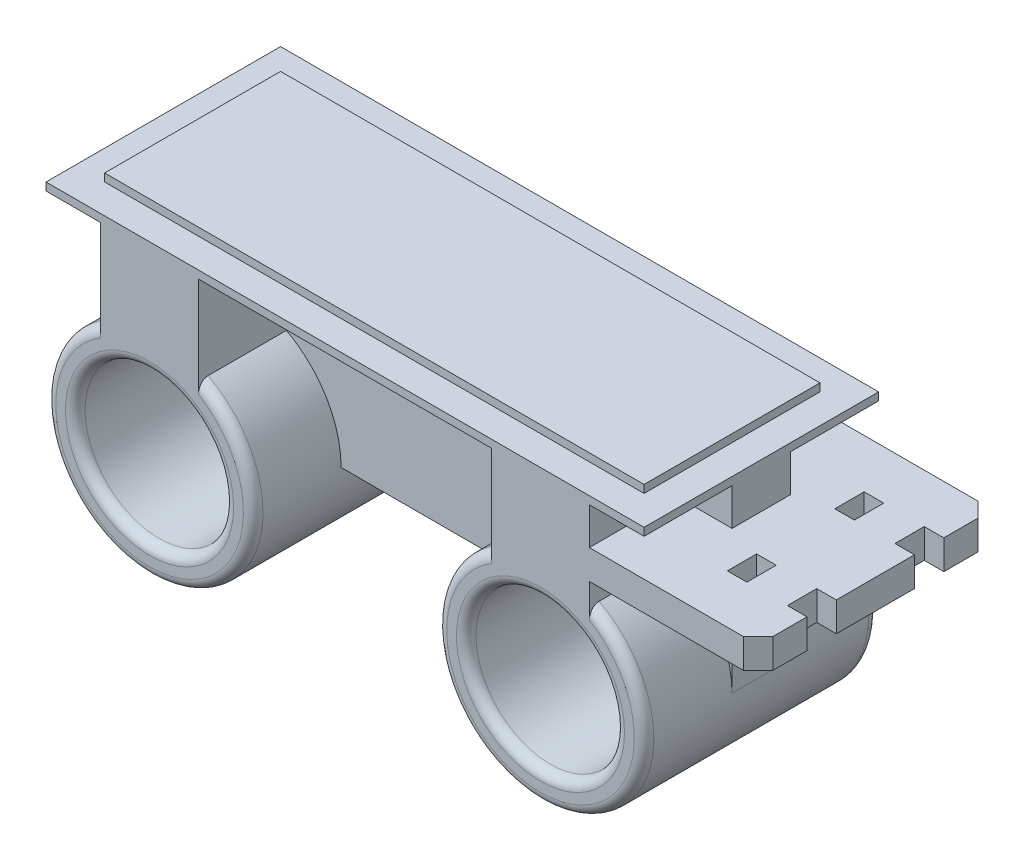
from build123d import *

# Parameters (mm, degrees)
ESBO_O1_R                  = 10.6
ESBO_O1_R_2                = 7.6
RESSALTO_EXTRUS_O1_DEPTH   = 12
RESSALTO_EXTRUS_O1_2_DEPTH = 12
FILETE1_R                  = 1
FILETE2_R                  = 1
RESSALTO_EXTRUS_O2_DEPTH   = 3
RESSALTO_EXTRUS_O3_DEPTH   = 12
ESBO_O5_W                  = 61.2
ESBO_O5_H                  = 24
ESBO_O5_W_2                = 55.2
ESBO_O5_H_2                = 18
CORTE_EXTRUS_O1_DEPTH      = 0.8
ESBO_O6_W                  = 24
ESBO_O6_H                  = 3
RESSALTO_EXTRUS_O4_DEPTH   = 22
ESBO_O9_W                  = 2
ESBO_O9_H                  = 3
CORTE_EXTRUS_O2_DEPTH      = 10
CHANFRO1_SIZE              = 1.5


with BuildPart() as part:
    # Esboço1 → Ressalto-extrusão1 (new, symmetric)
    with BuildSketch(Plane.XY):
        with Locations((-20, 0)):
            Circle(ESBO_O1_R)
        with Locations((-20, 0)):
            Circle(ESBO_O1_R_2, mode=Mode.SUBTRACT)
    extrude(amount=RESSALTO_EXTRUS_O1_DEPTH, both=True)

    # Filete1
    filete1_edges = [part.edges().sort_by_distance(p)[0] for p in [
        (-30.6, 0, -12),
        (-30.6, 0, 12),
        (-27.6, 0, -12),
        (-27.6, 0, 12),
    ]]
    fillet(filete1_edges, radius=FILETE1_R)



with BuildPart() as body_2:
    # Esboço1 → Ressalto-extrus_o1 2 (new, symmetric)
    with BuildSketch(Plane.XY):
        with Locations((20, 0)):
            Circle(ESBO_O1_R)
        with Locations((20, 0)):
            Circle(ESBO_O1_R_2, mode=Mode.SUBTRACT)
    extrude(amount=RESSALTO_EXTRUS_O1_2_DEPTH, both=True)

    # Filete2
    filete2_edges = [body_2.edges().sort_by_distance(p)[0] for p in [
        (12.4, 0, -12),
        (12.4, 0, 12),
        (9.4, 0, -12),
        (9.4, 0, 12),
    ]]
    fillet(filete2_edges, radius=FILETE2_R)


with BuildPart() as part_1:
    add(part.part)

    add(body_2.part)  # Ressalto-extrusão2 merges body 2
    # Esboço2 → Ressalto-extrusão2 (add, symmetric)
    with BuildSketch(Plane.XY):
        with BuildLine():
            Line((-30.6, 0), (-30.6, 20))
            Line((-30.6, 20), (30.6, 20))
            Line((30.6, 20), (30.6, 0))
            ThreePointArc((30.6, 0), (20, 10.6), (9.4, 0))
            Line((9.4, 0), (-9.4, 0))
            ThreePointArc((-9.4, 0), (-20, 10.6), (-30.6, 0))
        make_face()
    extrude(amount=RESSALTO_EXTRUS_O2_DEPTH, both=True)

    # Esboço3 → Ressalto-extrusão3 (add, symmetric)
    with BuildSketch(Plane.XY):
        with BuildLine():
            Line((-30.6, 20), (30.6, 20))
            Line((30.6, 20), (30.6, 18.4))
            Line((30.6, 18.4), (25, 18.4))
            Line((25, 18.4), (25, 8.195120499))
            ThreePointArc((25, 8.195120499), (20, 9.6), (15, 8.195120499))
            Line((15, 8.195120499), (15, 18.4))
            Line((15, 18.4), (-15, 18.4))
            Line((-15, 18.4), (-15, 8.195120499))
            ThreePointArc((-15, 8.195120499), (-20, 9.6), (-25, 8.195120499))
            Line((-25, 8.195120499), (-25, 18.4))
            Line((-25, 18.4), (-30.6, 18.4))
            Line((-30.6, 18.4), (-30.6, 20))
        make_face()
    extrude(amount=RESSALTO_EXTRUS_O3_DEPTH, both=True)

    # Esboço5 → Corte-extrusão1 (cut)
    with BuildSketch(Plane(origin=(0, 20, 0), x_dir=(1, 0, 0), z_dir=(0, 1, 0))):
        Rectangle(ESBO_O5_W, ESBO_O5_H)
        Rectangle(ESBO_O5_W_2, ESBO_O5_H_2, mode=Mode.SUBTRACT)
    extrude(amount=-CORTE_EXTRUS_O1_DEPTH, mode=Mode.SUBTRACT)

    # Esboço6 → Ressalto-extrusão4 (add)
    with BuildSketch(Plane(origin=(42.27, 0, 0), x_dir=(0, 0, -1), z_dir=(1, 0, 0))):
        with Locations((0, 13.1)):
            Rectangle(ESBO_O6_W, ESBO_O6_H)
    extrude(amount=-RESSALTO_EXTRUS_O4_DEPTH)

    # Esboço9 → Corte-extrusão2 (cut)
    with BuildSketch(Plane(origin=(0, 14.6, 0), x_dir=(1, 0, 0), z_dir=(0, 1, 0))):
        with Locations((41.27, 5.5)):
            Rectangle(ESBO_O9_W, ESBO_O9_H)
        with Locations((41.27, -5.5)):
            Rectangle(ESBO_O9_W, ESBO_O9_H)
        with Locations((35.12, 5.5)):
            Rectangle(ESBO_O9_W, ESBO_O9_H)
        with Locations((35.12, -5.5)):
            Rectangle(ESBO_O9_W, ESBO_O9_H)
    extrude(amount=-CORTE_EXTRUS_O2_DEPTH, mode=Mode.SUBTRACT)

    # Chanfro1
    chanfro1_edges = [part_1.edges().sort_by_distance(p)[0] for p in [
        (42.27, 13.1, -12),
        (42.27, 13.1, 12),
    ]]
    chamfer(chanfro1_edges, length=CHANFRO1_SIZE)


solid = part_1.part
